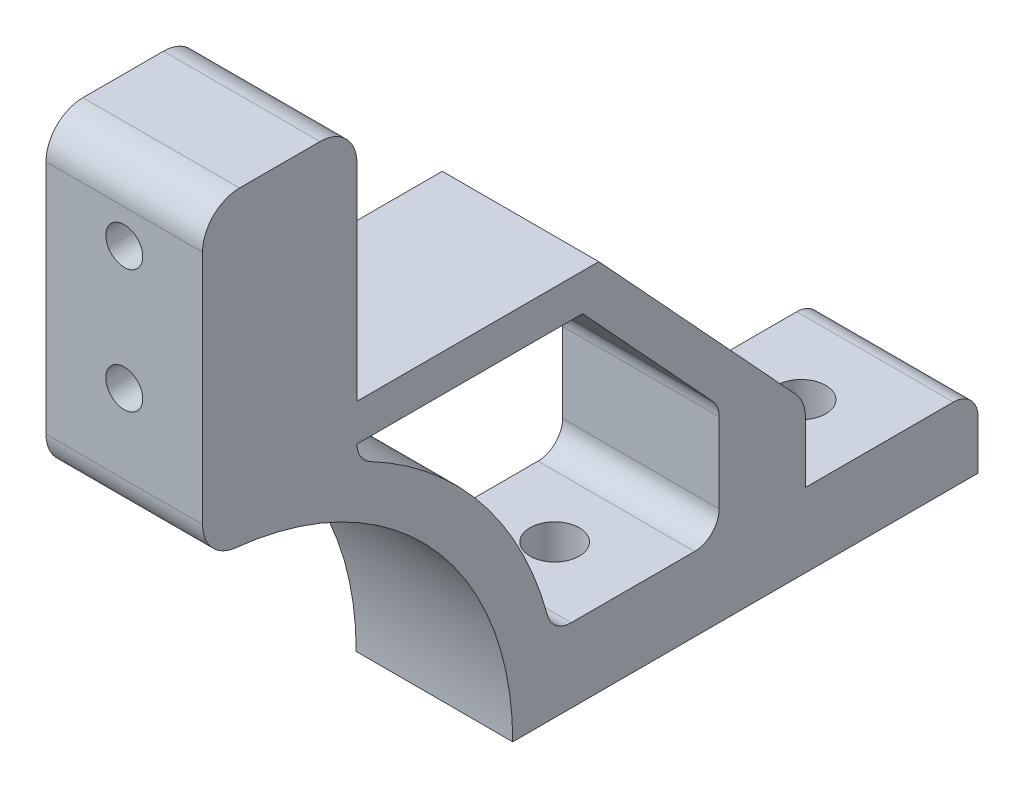
from build123d import *

# Parameters (mm, degrees)
BOSS_EXTRUDE2_DEPTH   = 12.7
CROQUIS3_R            = 2
CORTAR_EXTRUIR2_DEPTH = 25
CROQUIS5_R            = 1.5
CORTAR_EXTRUIR3_DEPTH = 17


with BuildPart() as part:
    # Sketch1 → Boss-Extrude2 (new body)
    with BuildSketch(Plane(origin=(0, 0, 0), x_dir=(0, 0, -1), z_dir=(1, 0, 0))):
        with BuildLine():
            Line((49.204101374, 10.956842444), (33.23486306, 28.251581588))
            Line((33.23486306, 28.251581588), (13.61439919, 28.251581588))
            Line((13.61439919, 28.251581588), (13.61439919, 39.964229912))
            Line((13.61439919, 39.964229912), (13.61439919, 45))
            ThreePointArc((13.61439919, 45), (12.735719533, 47.121320344), (10.61439919, 48))
            Line((10.61439919, 48), (4.084684606, 48))
            ThreePointArc((4.084684606, 48), (1.963364263, 47.121320344), (1.084684606, 45))
            Line((1.084684606, 45), (1.084684606, 25.857413306))
            ThreePointArc((1.084684606, 25.857413306), (1.858719017, 23.846175579), (3.781402736, 22.872782658))
            ThreePointArc((3.781402736, 22.872782658), (19.803767064, 14.76117498), (26.254053819, -1.999139412))
            Line((26.254053819, -1.999139412), (64, -1.999139412))
            Line((64, -1.999139412), (64, 2.000860588))
            ThreePointArc((64, 2.000860588), (63.414213562, 3.41507415), (62, 4.000860588))
            Line((62, 4.000860588), (50, 4.000860588))
            Line((50, 4.000860588), (50, 8.921667481))
            ThreePointArc((50, 8.921667481), (49.793949187, 10.014300969), (49.204101374, 10.956842444))
        make_face()
        with BuildLine():
            Line((42.469400916, 13.828321623), (31.921640745, 25.251581588))
            Line((31.921640745, 25.251581588), (13.61439919, 25.251581588))
            ThreePointArc((13.61439919, 25.251581588), (13.901973758, 24.218334695), (14.681998331, 23.482223332))
            ThreePointArc((14.681998331, 23.482223332), (23.753909667, 15.98324163), (29.068629616, 5.481429706))
            ThreePointArc((29.068629616, 5.481429706), (29.78321361, 4.413589067), (31, 4.000860588))
            Line((31, 4.000860588), (41, 4.000860588))
            ThreePointArc((41, 4.000860588), (42.414213562, 4.586647025), (43, 6.000860588))
            Line((43, 6.000860588), (43, 12.471538314))
            ThreePointArc((43, 12.471538314), (42.862632792, 13.199960639), (42.469400916, 13.828321623))
        make_face(mode=Mode.SUBTRACT)
    extrude(amount=BOSS_EXTRUDE2_DEPTH)

    # Croquis3 → Cortar-Extruir2 (cut)
    with BuildSketch(Plane(origin=(0, 4.000860588, 0), x_dir=(1, 0, 0), z_dir=(0, 1, 0))):
        with Locations(Location((6.35, 56, 0), (0, 0, 270))):
            Circle(CROQUIS3_R)
        with Locations(Location((6.35, 36, 0), (0, 0, 270))):
            Circle(CROQUIS3_R)
    extrude(amount=-CORTAR_EXTRUIR2_DEPTH, mode=Mode.SUBTRACT)

    # Croquis5 → Cortar-Extruir3 (cut)
    with BuildSketch(Plane(origin=(0, 0, -13.61439919), x_dir=(-1, 0, 0), z_dir=(0, 0, -1))):
        with Locations(Location((-6.35, 32.251581588, 0), (0, 0, 90))):
            Circle(CROQUIS5_R)
        with Locations(Location((-6.35, 42.251581588, 0), (0, 0, 90))):
            Circle(CROQUIS5_R)
    extrude(amount=-CORTAR_EXTRUIR3_DEPTH, mode=Mode.SUBTRACT)


solid = part.part
